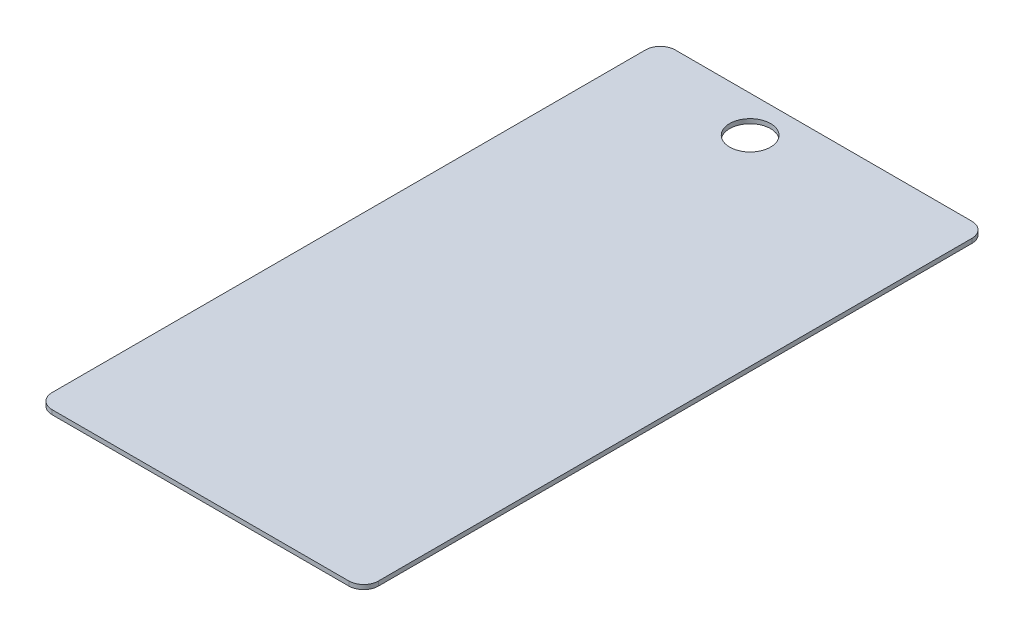
from build123d import *

# Parameters (mm, degrees)
BOSS_EXTRUDE1_DEPTH = 0.3
CUT_EXTRUDE1_REACH  = 26.487
SKETCH5_R           = 1.37778755


with BuildPart() as part:
    # Sketch1 → Boss-Extrude1 (new body)
    with BuildSketch(Plane(origin=(0, 0, 0), x_dir=(1, 0, 0), z_dir=(0, 1, 0))):
        with BuildLine():
            Line((-10.68004988, 20.47995012), (9.31995012, 20.47995012))
            ThreePointArc((9.31995012, 20.47995012), (10.027056901, 20.187056901), (10.31995012, 19.47995012))
            Line((10.31995012, 19.47995012), (10.31995012, -20.52004988))
            ThreePointArc((10.31995012, -20.52004988), (10.027056901, -21.227156662), (9.31995012, -21.52004988))
            Line((9.31995012, -21.52004988), (-10.68004988, -21.52004988))
            ThreePointArc((-10.68004988, -21.52004988), (-11.387156662, -21.227156662), (-11.68004988, -20.52004988))
            Line((-11.68004988, -20.52004988), (-11.68004988, 19.47995012))
            ThreePointArc((-11.68004988, 19.47995012), (-11.387156662, 20.187056901), (-10.68004988, 20.47995012))
        make_face()
    extrude(amount=BOSS_EXTRUDE1_DEPTH)

    # Sketch5 → Cut-Extrude1 (cut, up to next)
    with BuildSketch(Plane(origin=(0, 0.3, 0), x_dir=(1, 0, 0), z_dir=(0, 1, 0)), mode=Mode.PRIVATE) as cut_extrude1_sk1:
        with Locations(Location((-3.169591585, 18.020060764, 0), (0, 0, 270))):
            Circle(SKETCH5_R)
    cut_extrude1_tool1 = extrude(cut_extrude1_sk1.sketch, amount=-CUT_EXTRUDE1_REACH, mode=Mode.PRIVATE) & part.part
    add(cut_extrude1_tool1.solids().sort_by_distance((-3.169592, 0.3, -18.020061))[0], mode=Mode.SUBTRACT)


solid = part.part
